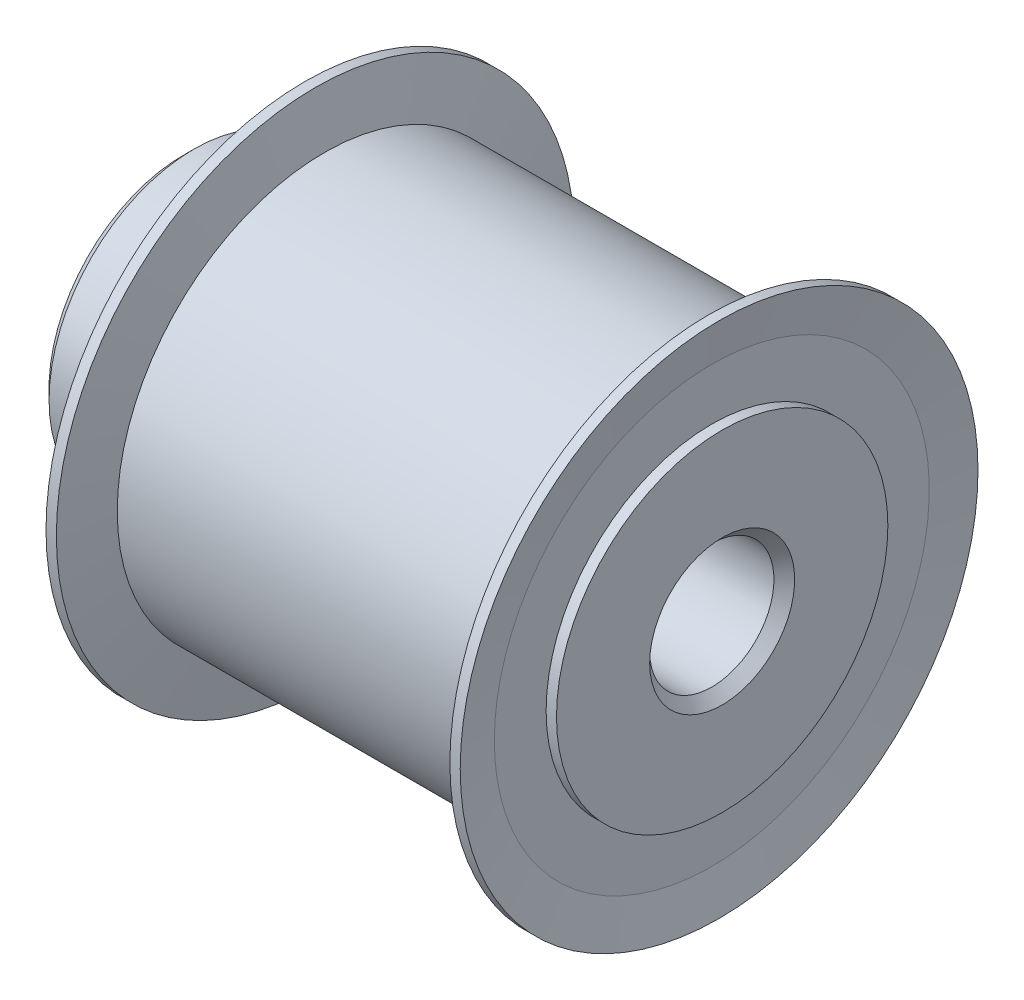
from build123d import *

# Parameters (mm, degrees)
FASE1_SIZE = 0.5


with BuildPart() as part:
    # Skizze1 → Rotation1 (revolve)
    with BuildSketch(Plane.XY, mode=Mode.PRIVATE) as rotation1_sk:
        Polygon((0, 3), (26, 3), (26, 8), (25.5, 8), (25.5, 10.5), (25.852653961, 12.5), (25.352653961, 12.5), (24.91183651, 10), (6.793471413, 10), (6.352653961, 12.5), (5.852653961, 12.5), (6.205307923, 10.5), (6.205307923, 8), (5.705307923, 8), (5.705307923, 7), (0, 7), align=None)
    revolve(rotation1_sk.sketch.rotate(Axis((0, 0, 0), (1, 0, 0)), 90), axis=Axis((0, 0, 0), (1, 0, 0)))

    # Fase1
    fase1_edges = [part.edges().sort_by_distance(p)[0] for p in [
        (0, 0, -3),
        (26, 0, -3),
        (0, 0, -7),
    ]]
    chamfer(fase1_edges, length=FASE1_SIZE)


solid = part.part
